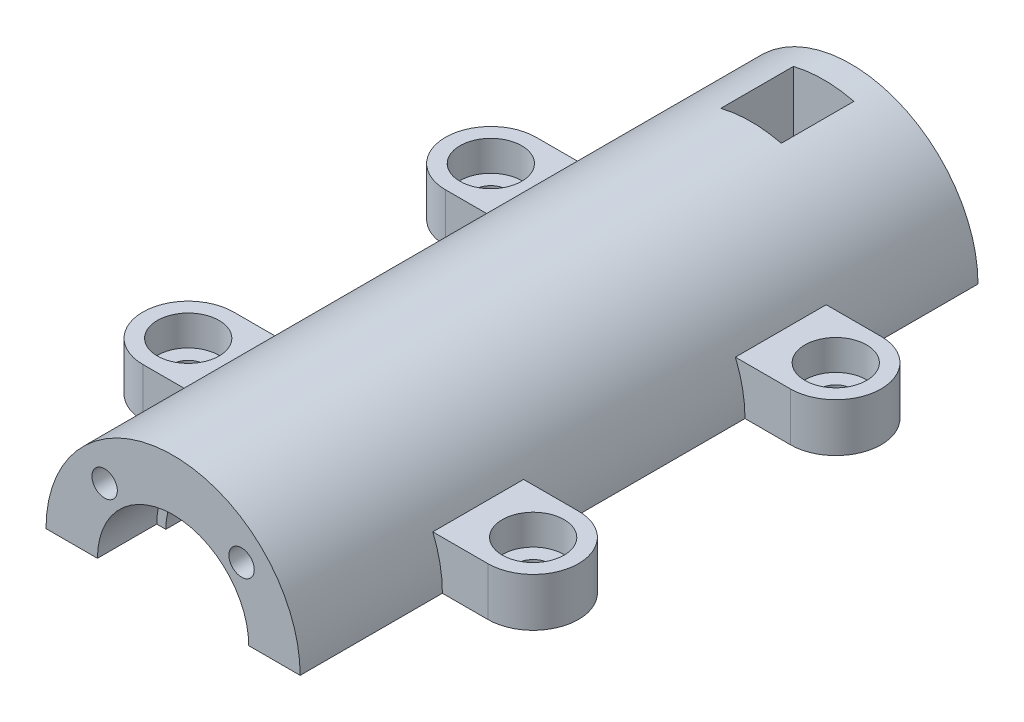
from build123d import *

# Parameters (mm, degrees)
SKETCH_1_W                  = 21
SKETCH_1_H                  = 112
CUT_EXTRUDE_1_REACH         = 117.871
SKETCH_3_W                  = 42
SKETCH_3_H                  = 25
SKETCH_4_W                  = 15
SKETCH_4_H                  = 8
EXTRUDE_1_DEPTH             = 15
EXTRUDE_1_DIRECTION_2_REACH = 123.445
CUT_EXTRUDE_2_DEPTH         = 8
SKETCH_6_R                  = 2.6
CUT_EXTRUDE_3_DEPTH         = 8
SKETCH_7_R                  = 5.1
CUT_EXTRUDE_4_DEPTH         = 5
PATTERN_LINEAR_1_COUNT      = 2
PATTERN_LINEAR_1_PITCH      = 50
MIRROR_1_COPY_1_SKETCH_W    = 15
MIRROR_1_COPY_1_SKETCH_H    = 8
MIRROR_1_COPY_1_DEPTH       = 15
MIRROR_1_COPY_2_REACH       = 123.445
MIRROR_1_COPY_2_SKETCH_W    = 15
MIRROR_1_COPY_2_SKETCH_H    = 8
MIRROR_1_COPY_3_DEPTH       = 8
MIRROR_1_COPY_4_SKETCH_R    = 2.6
MIRROR_1_COPY_4_DEPTH       = 8
MIRROR_1_COPY_5_SKETCH_R    = 5.1
MIRROR_1_COPY_5_DEPTH       = 5
PATTERN_CIRCULAR_1_COUNT    = 2
PATTERN_CIRCULAR_1_ANGLE    = 90
CUT_EXTRUDE_6_REACH         = 121.503
CUT_EXTRUDE_6_END_RADIUS    = 21
SKETCH_9_W                  = 10
SKETCH_9_H                  = 12


with BuildPart() as part:
    # Эскиз1 → Повернуть1 (revolve)
    with BuildSketch(Plane(origin=(0, 0, 0), x_dir=(1, 0, 0), z_dir=(0, 1, 0))):
        with Locations((10.5, 56)):
            Rectangle(SKETCH_1_W, SKETCH_1_H)
    revolve(axis=Axis((0, 0, 0), (0, 0, -1)))

    # Эскиз2 → Вырез-Повернуть1 (revolve, cut)
    with BuildSketch(Plane(origin=(0, 0, 0), x_dir=(1, 0, 0), z_dir=(0, 1, 0)), mode=Mode.PRIVATE) as cut_revolve_1_sk:
        Polygon((0, 0), (12.5, 0), (12.5, 9.8), (11, 9.8), (11, 98.5), (5, 98.5), (5, 107.5), (11, 107.5), (11, 112), (0, 112), align=None)
    revolve(cut_revolve_1_sk.sketch.rotate(Axis((0, 0, -112), (0, 0, 1)), 180), axis=Axis((0, 0, -112), (0, 0, 1)), mode=Mode.SUBTRACT)

    # Вырез-Вытянуть1: up to this face of the body (flat: up to its plane)
    cut_extrude_1_end = Plane(part.part.faces().sort_by_distance((-20.406030304, 0, -112))[0])
    # Эскиз3 → Вырез-Вытянуть1 (cut, up to the picked face)
    with BuildSketch(Plane.XY, mode=Mode.PRIVATE) as cut_extrude_1_sk1:
        with Locations((0, -12.5)):
            Rectangle(SKETCH_3_W, SKETCH_3_H)
    cut_extrude_1_tool1 = split(extrude(cut_extrude_1_sk1.sketch, amount=-CUT_EXTRUDE_1_REACH, mode=Mode.PRIVATE), bisect_by=cut_extrude_1_end, keep=Keep.BOTH, mode=Mode.PRIVATE)
    add(cut_extrude_1_tool1.solids().sort_by(Axis((0, -12.5, 0), (0, 0, -1)))[0], mode=Mode.SUBTRACT)

    # Эскиз4 → Бобышка-Вытянуть1 (add)
    with BuildSketch(Plane(origin=(21, 0, 0), x_dir=(0, 0, -1), z_dir=(1, 0, 0))):
        with Locations((31, 4)):
            Rectangle(SKETCH_4_W, SKETCH_4_H)
    extrude_1 = extrude(amount=EXTRUDE_1_DEPTH)

    # Эскиз4 → Бобышка-Вытянуть1 direction 2 (add, up to next)
    with BuildSketch(Plane(origin=(21, 0, 0), x_dir=(0, 0, -1), z_dir=(1, 0, 0)), mode=Mode.PRIVATE) as extrude_1_direction_2_sk1:
        with Locations((31, 4)):
            Rectangle(SKETCH_4_W, SKETCH_4_H)
    extrude_1_direction_2_tool1 = extrude(extrude_1_direction_2_sk1.sketch, amount=-EXTRUDE_1_DIRECTION_2_REACH, mode=Mode.PRIVATE) - part.part
    extrude_1_direction_2 = extrude_1_direction_2_tool1.solids().sort_by_distance((21, 4, -31))[0]
    add(extrude_1_direction_2)

    # Эскиз5 → Вырез-Вытянуть2 (cut)
    with BuildSketch(Plane(origin=(0, 8, 0), x_dir=(1, 0, 0), z_dir=(0, 1, 0))):
        with BuildLine():
            Line((28.5, 38.5), (43.5, 38.5))
            Line((43.5, 38.5), (43.5, 23.5))
            Line((43.5, 23.5), (28.5, 23.5))
            ThreePointArc((28.5, 23.5), (36, 31), (28.5, 38.5))
        make_face()
    cut_extrude_2 = extrude(amount=-CUT_EXTRUDE_2_DEPTH, mode=Mode.SUBTRACT)

    # Эскиз6 → Вырез-Вытянуть3 (cut)
    with BuildSketch(Plane(origin=(0, 8, 0), x_dir=(1, 0, 0), z_dir=(0, 1, 0))):
        with Locations(Location((28.5, 31, 0), (0, 0, 270))):
            Circle(SKETCH_6_R)
    cut_extrude_3 = extrude(amount=-CUT_EXTRUDE_3_DEPTH, mode=Mode.SUBTRACT)

    # Эскиз7 → Вырез-Вытянуть4 (cut)
    with BuildSketch(Plane(origin=(0, 8, 0), x_dir=(1, 0, 0), z_dir=(0, 1, 0))):
        with Locations(Location((28.5, 31, 0), (0, 0, 270))):
            Circle(SKETCH_7_R)
    cut_extrude_4 = extrude(amount=-CUT_EXTRUDE_4_DEPTH, mode=Mode.SUBTRACT)

    # Линейный массив1: Бобышка-Вытянуть1, Бобышка-Вытянуть1 direction 2, Вырез-Вытянуть2, Вырез-Вытянуть3, Вырез-Вытянуть4 ×2
    with Locations(*[(0, 0, -i * PATTERN_LINEAR_1_PITCH) for i in range(1, PATTERN_LINEAR_1_COUNT)]):
        add(extrude_1)
        add(extrude_1_direction_2)
        add(cut_extrude_2, mode=Mode.SUBTRACT)
        add(cut_extrude_3, mode=Mode.SUBTRACT)
        add(cut_extrude_4, mode=Mode.SUBTRACT)

    # Зеркальное отражение1: Бобышка-Вытянуть1, Бобышка-Вытянуть1 direction 2, Вырез-Вытянуть2, Вырез-Вытянуть3, Вырез-Вытянуть4 across plane
    add(extrude_1.mirror(Plane(origin=(0, 0, 0), x_dir=(0, 0, 1), z_dir=(1, 0, 0))))
    add(extrude_1_direction_2.mirror(Plane(origin=(0, 0, 0), x_dir=(0, 0, 1), z_dir=(1, 0, 0))))
    add(cut_extrude_2.mirror(Plane(origin=(0, 0, 0), x_dir=(0, 0, 1), z_dir=(1, 0, 0))), mode=Mode.SUBTRACT)
    add(cut_extrude_3.mirror(Plane(origin=(0, 0, 0), x_dir=(0, 0, 1), z_dir=(1, 0, 0))), mode=Mode.SUBTRACT)
    add(cut_extrude_4.mirror(Plane(origin=(0, 0, 0), x_dir=(0, 0, 1), z_dir=(1, 0, 0))), mode=Mode.SUBTRACT)

    # Зеркальное отражение1 copy 1 sketch → Зеркальное отражение1 copy 1 (add)
    with BuildSketch(Plane(origin=(-21, 0, -50), x_dir=(0, 0, -1), z_dir=(-1, 0, 0))):
        with Locations((31, -4)):
            Rectangle(MIRROR_1_COPY_1_SKETCH_W, MIRROR_1_COPY_1_SKETCH_H)
    extrude(amount=MIRROR_1_COPY_1_DEPTH)

    # Зеркальное отражение1 copy 2 sketch → Зеркальное отражение1 copy 2 (add, up to next)
    with BuildSketch(Plane(origin=(-21, 0, -50), x_dir=(0, 0, -1), z_dir=(-1, 0, 0)), mode=Mode.PRIVATE) as mirror_1_copy_2_sk1:
        with Locations((31, -4)):
            Rectangle(MIRROR_1_COPY_2_SKETCH_W, MIRROR_1_COPY_2_SKETCH_H)
    mirror_1_copy_2_tool1 = extrude(mirror_1_copy_2_sk1.sketch, amount=-MIRROR_1_COPY_2_REACH, mode=Mode.PRIVATE) - part.part
    add(mirror_1_copy_2_tool1.solids().sort_by_distance((-21, 4, -81))[0])

    # Зеркальное отражение1 copy 3 sketch → Зеркальное отражение1 copy 3 (cut)
    with BuildSketch(Plane(origin=(0, 8, -50), x_dir=(-1, 0, 0), z_dir=(0, 1, 0))):
        with BuildLine():
            Line((28.5, -38.5), (43.5, -38.5))
            Line((43.5, -38.5), (43.5, -23.5))
            Line((43.5, -23.5), (28.5, -23.5))
            ThreePointArc((28.5, -23.5), (36, -31), (28.5, -38.5))
        make_face()
    extrude(amount=-MIRROR_1_COPY_3_DEPTH, mode=Mode.SUBTRACT)

    # Зеркальное отражение1 copy 4 sketch → Зеркальное отражение1 copy 4 (cut)
    with BuildSketch(Plane(origin=(0, 8, -50), x_dir=(-1, 0, 0), z_dir=(0, 1, 0))):
        with Locations((28.5, -31)):
            Circle(MIRROR_1_COPY_4_SKETCH_R)
    extrude(amount=-MIRROR_1_COPY_4_DEPTH, mode=Mode.SUBTRACT)

    # Зеркальное отражение1 copy 5 sketch → Зеркальное отражение1 copy 5 (cut)
    with BuildSketch(Plane(origin=(0, 8, -50), x_dir=(-1, 0, 0), z_dir=(0, 1, 0))):
        with Locations((28.5, -31)):
            Circle(MIRROR_1_COPY_5_SKETCH_R)
    extrude(amount=-MIRROR_1_COPY_5_DEPTH, mode=Mode.SUBTRACT)

    # Эскиз8 → Сверление под метчик M51 (revolve, cut)
    with BuildSketch(Plane(origin=(11.313708499, 11.313708499, 0), x_dir=(0, -1, 0), z_dir=(1, 0, 0))):
        Polygon((0, 0), (0, 26.2618073), (2.1, 25), (2.1, 0), align=None)
    hole_wizard_m51 = revolve(axis=Axis((11.313708499, 11.313708499, 6.35), (0, 0, -1)), mode=Mode.SUBTRACT)

    # Круговой массив1: Сверление под метчик M51 ×2 about axis
    pattern_circular_1_axis = Axis((0, 0, 0), (0, 0, 1))
    for i in range(1, PATTERN_CIRCULAR_1_COUNT):
        add(hole_wizard_m51.rotate(pattern_circular_1_axis, i * PATTERN_CIRCULAR_1_ANGLE / (PATTERN_CIRCULAR_1_COUNT - 1)), mode=Mode.SUBTRACT)

    # Зеркальное отражение2: Сверление под метчик M51 across plane
    add(hole_wizard_m51.mirror(Plane.XY.offset(-56)), mode=Mode.SUBTRACT)

    # Зеркальное отражение2 copy 1 sketch → Зеркальное отражение2 copy 1 (revolve, cut)
    with BuildSketch(Plane(origin=(-11.313708499, 11.313708499, -112), x_dir=(1, 0, 0), z_dir=(0, 1, 0))):
        Polygon((0, 0), (0, -26.2618073), (2.1, -25), (2.1, 0), align=None)
    revolve(axis=Axis((-11.313708499, 11.313708499, -118.35), (0, 0, -1)), mode=Mode.SUBTRACT)

    # Вырез-Вытянуть6: up to this cylinder (the profile starts inside it)
    cut_extrude_6_end = Plane(origin=(0, 0, -101.5), z_dir=(0, 0, 1)) * Cylinder(CUT_EXTRUDE_6_END_RADIUS, 286.006, mode=Mode.PRIVATE)
    # Эскиз9 → Вырез-Вытянуть6 (cut, up to the surface)
    with BuildSketch(Plane(origin=(0, 0, 0), x_dir=(1, 0, 0), z_dir=(0, 1, 0)), mode=Mode.PRIVATE) as cut_extrude_6_sk1:
        with Locations((0, 101.5)):
            Rectangle(SKETCH_9_W, SKETCH_9_H)
    cut_extrude_6_tool1 = extrude(cut_extrude_6_sk1.sketch, amount=CUT_EXTRUDE_6_REACH, mode=Mode.PRIVATE) & cut_extrude_6_end
    add(cut_extrude_6_tool1.solids().sort_by_distance((0, 0, -101.5))[0], mode=Mode.SUBTRACT)


solid = part.part
